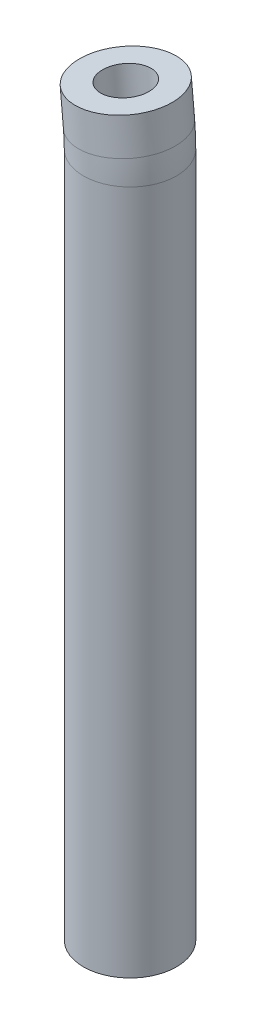
from build123d import *

# Parameters (mm, degrees)
SKETCH2_R   = 2
SKETCH2_R_2 = 1


with BuildPart() as part:
    # Sweep1: sweep along a path in Sketch1
    with BuildLine(Plane.XY) as sweep1_path:
        Line((0, 0), (0, 29.44415371510814))
        ThreePointArc((0, 29.44415371510814), (-0.01037362759450922, 29.899527122040023), (-0.04147298794814702, 30.353955754143914))
        Line((-0.04147298794814702, 30.353955754143914), (-0.18271819475604392, 31.900000000000006))
    # Sketch2 → Sweep1 (sweep)
    with BuildSketch(Plane(origin=(0, 0, 0), x_dir=(1, 0, 0), z_dir=(0, 1, 0))):
        Circle(SKETCH2_R)
        Circle(SKETCH2_R_2, mode=Mode.SUBTRACT)
    sweep(path=sweep1_path.line)


solid = part.part
